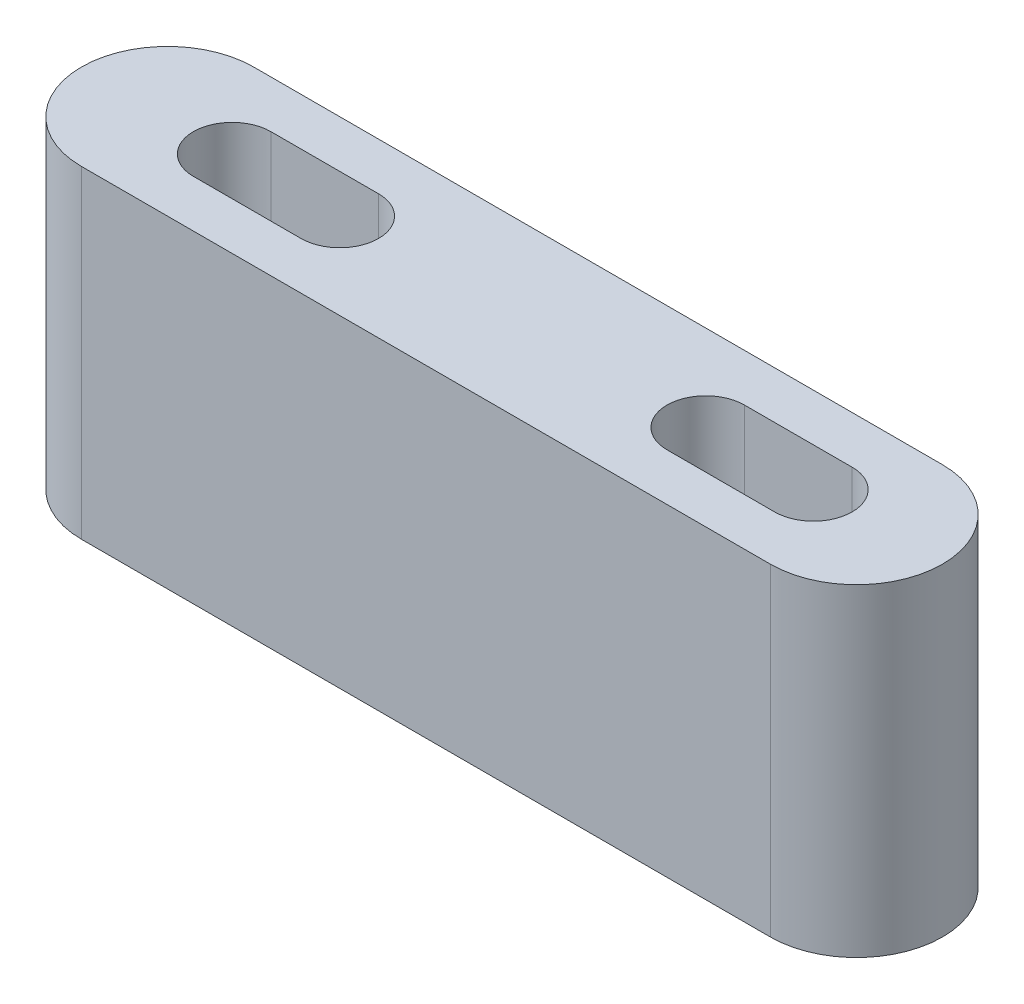
from build123d import *

# Parameters (mm, degrees)
BOSS_EXTRUDE2_DEPTH = 15
CUT_EXTRUDE1_DEPTH  = 40.812058475


with BuildPart() as part:
    # Sketch5 → Boss-Extrude2 (new body)
    with BuildSketch(Plane(origin=(0, 0, 0), x_dir=(1, 0, 0), z_dir=(0, 1, 0))):
        with BuildLine():
            Line((0, 0), (32, 0))
            ThreePointArc((32, 0), (36, 4), (32, 8))
            Line((32, 8), (0, 8))
            ThreePointArc((0, 8), (-4, 4), (0, 0))
        make_face()
    extrude(amount=BOSS_EXTRUDE2_DEPTH)

    # Sketch8 → Cut-Extrude1 (cut, through all)
    with BuildSketch(Plane(origin=(0, 15, 0), x_dir=(1, 0, 0), z_dir=(0, 1, 0))):
        with BuildLine():
            Line((3, 5.8), (8, 5.8))
            ThreePointArc((8, 5.8), (9.8, 4), (8, 2.2))
            Line((8, 2.2), (3, 2.2))
            ThreePointArc((3, 2.2), (1.2, 4), (3, 5.8))
        make_face()
        with BuildLine():
            Line((25, 5.8), (30, 5.8))
            ThreePointArc((30, 5.8), (31.8, 4), (30, 2.2))
            Line((30, 2.2), (25, 2.2))
            ThreePointArc((25, 2.2), (23.2, 4), (25, 5.8))
        make_face()
    extrude(amount=-CUT_EXTRUDE1_DEPTH, mode=Mode.SUBTRACT)


solid = part.part
